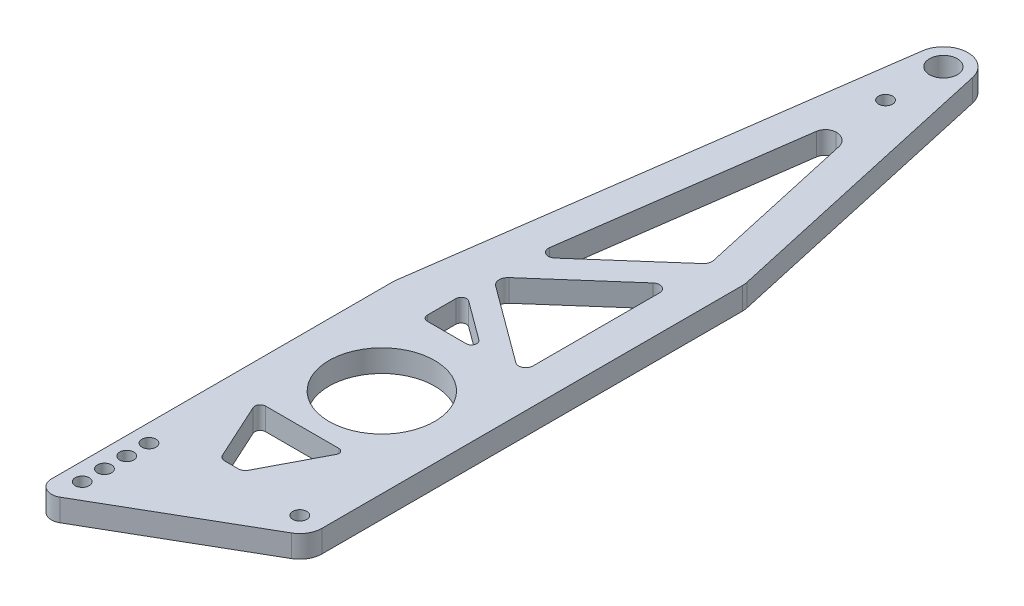
from build123d import *

# Parameters (mm, degrees)
SKETCH1_R           = 3.96875
SKETCH1_R_2         = 15.08125
SKETCH1_R_3         = 2
BOSS_EXTRUDE1_DEPTH = 6.35
FILLET5_R           = 4.064
FILLET6_R           = 3.048
FILLET7_R           = 2.54
FILLET8_R           = 2.032
FILLET9_R           = 2.032
FILLET10_R          = 2.54
FILLET11_R          = 2.032
FILLET12_R          = 1.524
FILLET13_R          = 1.524
FILLET14_R          = 1.524
FILLET17_R          = 1.27
FILLET18_R          = 1.524
FILLET19_R          = 2.032
FILLET20_R          = 2.032


with BuildPart() as part:
    # Sketch1 → Boss-Extrude1 (new body)
    with BuildSketch(Plane(origin=(0, 0, 0), x_dir=(1, 0, 0), z_dir=(0, 1, 0))):
        with BuildLine():
            Line((25.4, -82.735721877), (25.4, -202.708825791))
            ThreePointArc((25.4, -202.708825791), (24.549261314, -205.883825791), (22.225, -208.208087105))
            Line((22.225, -208.208087105), (-19.685, -232.404836886))
            ThreePointArc((-19.685, -232.404836886), (-23.495, -232.404836886), (-25.4, -229.105280098))
            Line((-25.4, -229.105280098), (-25.4, -131.278691098))
            Line((-25.4, -131.278691098), (-6.917767735, 0.966806375))
            ThreePointArc((-6.917767735, 0.966806375), (-0.279220673, 6.97941694), (6.818426198, 1.51634072))
            Line((6.818426198, 1.51634072), (25.248569271, -81.357230313))
            ThreePointArc((25.248569271, -81.357230313), (25.362028789, -82.042329806), (25.4, -82.735721877))
        make_face()
        with Locations(Location((0, 0, 0), (0, 0, 270))):
            Circle(SKETCH1_R, mode=Mode.SUBTRACT)
        with Locations(Location((0, -160.246508934, 0), (0, 0, 270))):
            Circle(SKETCH1_R_2, mode=Mode.SUBTRACT)
        with Locations(Location((-20.32, -225.425, 0), (0, 0, 270))):
            Circle(SKETCH1_R_3, mode=Mode.SUBTRACT)
        with Locations(Location((-20.32, -219.075, 0), (0, 0, 270))):
            Circle(SKETCH1_R_3, mode=Mode.SUBTRACT)
        with Locations(Location((-20.32, -212.725, 0), (0, 0, 270))):
            Circle(SKETCH1_R_3, mode=Mode.SUBTRACT)
        with Locations(Location((-20.32, -206.375, 0), (0, 0, 270))):
            Circle(SKETCH1_R_3, mode=Mode.SUBTRACT)
        with Locations(Location((0, -16.51, 0), (0, 0, 270))):
            Circle(SKETCH1_R_3, mode=Mode.SUBTRACT)
        with Locations(Location((19.05, -202.708825791, 0), (0, 0, 270))):
            Circle(SKETCH1_R_3, mode=Mode.SUBTRACT)
        Polygon((4.14169212, -31.481995576), (15.384809867, -82.038158574), (-12.257886656, -106.330908852), (-1.797228059, -31.481995576), (0, -31.481995576), align=None, mode=Mode.SUBTRACT)
        Polygon((15.384809867, -91.891539471), (-12.257886656, -116.184289749), (15.384809867, -136.541766952), align=None, mode=Mode.SUBTRACT)
        Polygon((-12.257886656, -123.848026735), (4.97849313, -136.541766952), (-12.257886656, -136.541766952), align=None, mode=Mode.SUBTRACT)
        Polygon((-15.24, -180.566508934), (10.16, -180.566508934), (0, -199.967922148), (-6.35, -199.967922148), align=None, mode=Mode.SUBTRACT)
    extrude(amount=-BOSS_EXTRUDE1_DEPTH)

    # Fillet5
    fillet5_edges = [part.edges().sort_by_distance(p)[0] for p in [
        (4.14169212, -3.175, 31.481995576),
    ]]
    fillet(fillet5_edges, radius=FILLET5_R)

    # Fillet6
    fillet6_edges = [part.edges().sort_by_distance(p)[0] for p in [
        (-1.797228059, -3.175, 31.481995576),
    ]]
    fillet(fillet6_edges, radius=FILLET6_R)

    # Fillet7
    fillet7_edges = [part.edges().sort_by_distance(p)[0] for p in [
        (15.384809867, -3.175, 82.038158574),
    ]]
    fillet(fillet7_edges, radius=FILLET7_R)

    # Fillet8
    fillet8_edges = [part.edges().sort_by_distance(p)[0] for p in [
        (-12.257886656, -3.175, 106.330908852),
    ]]
    fillet(fillet8_edges, radius=FILLET8_R)

    # Fillet9
    fillet9_edges = [part.edges().sort_by_distance(p)[0] for p in [
        (15.384809867, -3.175, 91.891539471),
    ]]
    fillet(fillet9_edges, radius=FILLET9_R)

    # Fillet10
    fillet10_edges = [part.edges().sort_by_distance(p)[0] for p in [
        (-12.257886656, -3.175, 116.184289749),
    ]]
    fillet(fillet10_edges, radius=FILLET10_R)

    # Fillet11
    fillet11_edges = [part.edges().sort_by_distance(p)[0] for p in [
        (15.384809867, -3.175, 136.541766952),
    ]]
    fillet(fillet11_edges, radius=FILLET11_R)

    # Fillet12
    fillet12_edges = [part.edges().sort_by_distance(p)[0] for p in [
        (-12.257886656, -3.175, 123.848026735),
    ]]
    fillet(fillet12_edges, radius=FILLET12_R)

    # Fillet13
    fillet13_edges = [part.edges().sort_by_distance(p)[0] for p in [
        (4.97849313, -3.175, 136.541766952),
    ]]
    fillet(fillet13_edges, radius=FILLET13_R)

    # Fillet14
    fillet14_edges = [part.edges().sort_by_distance(p)[0] for p in [
        (-12.257886656, -3.175, 136.541766952),
    ]]
    fillet(fillet14_edges, radius=FILLET14_R)

    # Fillet17
    fillet17_edges = [part.edges().sort_by_distance(p)[0] for p in [
        (10.16, -3.175, 180.566508934),
    ]]
    fillet(fillet17_edges, radius=FILLET17_R)

    # Fillet18
    fillet18_edges = [part.edges().sort_by_distance(p)[0] for p in [
        (-15.24, -3.175, 180.566508934),
    ]]
    fillet(fillet18_edges, radius=FILLET18_R)

    # Fillet19
    fillet19_edges = [part.edges().sort_by_distance(p)[0] for p in [
        (-6.35, -3.175, 199.967922148),
    ]]
    fillet(fillet19_edges, radius=FILLET19_R)

    # Fillet20
    fillet20_edges = [part.edges().sort_by_distance(p)[0] for p in [
        (0, -3.175, 199.967922148),
    ]]
    fillet(fillet20_edges, radius=FILLET20_R)


solid = part.part
